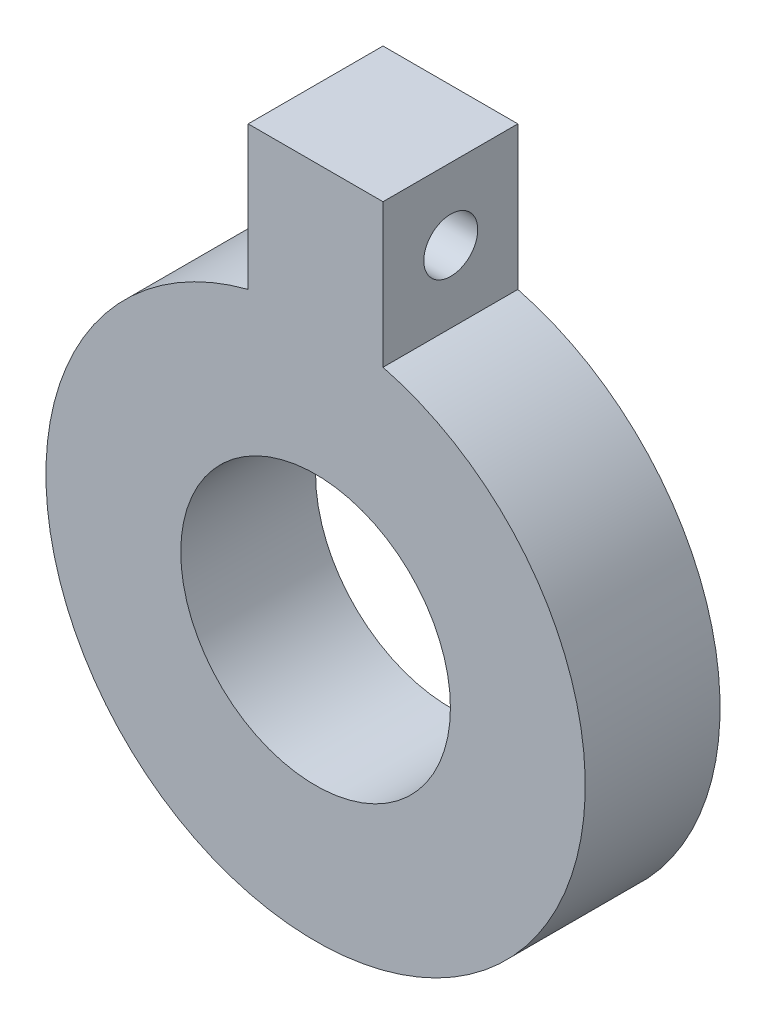
from build123d import *

# Parameters (mm, degrees)
ESQUISSE1_R             = 10
ESQUISSE1_R_2           = 5
BOSS_EXTRU_1_DEPTH      = 5
ESQUISSE2_W             = 5
ESQUISSE2_H             = 7
BOSS_EXTRU_2_DEPTH      = 5
ESQUISSE3_R             = 1
ENL_V_MAT_EXTRU_1_DEPTH = 10


with BuildPart() as part:
    # Esquisse1 → Boss.-Extru.1 (new body)
    with BuildSketch(Plane.XY):
        Circle(ESQUISSE1_R)
        Circle(ESQUISSE1_R_2, mode=Mode.SUBTRACT)
    extrude(amount=BOSS_EXTRU_1_DEPTH)

    # Esquisse2 → Boss.-Extru.2 (add)
    with BuildSketch(Plane.XY.offset(5)):
        with Locations((0, 11.5)):
            Rectangle(ESQUISSE2_W, ESQUISSE2_H)
    extrude(amount=-BOSS_EXTRU_2_DEPTH)

    # Esquisse3 → Enlèv. mat.-Extru.1 (cut)
    with BuildSketch(Plane(origin=(-2.5, 0, 0), x_dir=(0, -1, 0), z_dir=(-1, 0, 0))):
        with Locations((-12.345891544, 2.487364075)):
            Circle(ESQUISSE3_R)
    extrude(amount=-ENL_V_MAT_EXTRU_1_DEPTH, mode=Mode.SUBTRACT)


solid = part.part
